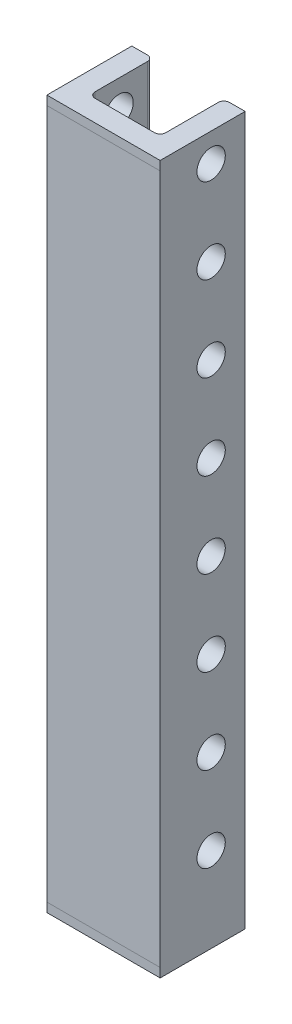
from build123d import *

# Parameters (mm, degrees)
BOSS_EXTRUDE1_DEPTH = 317.5
SKETCH2_R           = 6.35
CUT_EXTRUDE1_DEPTH  = 304.8
FILLET1_R           = 2.54


with BuildPart() as part:
    # Sketch1 → Boss-Extrude1 (new body)
    with BuildSketch(Plane(origin=(0, 0, 0), x_dir=(1, 0, 0), z_dir=(0, 1, 0))):
        Polygon((0, 0), (50.8, 0), (50.8, 38.1), (41.275, 38.1), (41.275, 9.525), (9.525, 9.525), (9.525, 38.1), (0, 38.1), align=None)
    extrude(amount=BOSS_EXTRUDE1_DEPTH)

    # Sketch2 → Cut-Extrude1 (cut)
    with BuildSketch(Plane(origin=(50.8, 0, 0), x_dir=(0, 0, -1), z_dir=(1, 0, 0))):
        with Locations((22.86, 304.8)):
            Circle(SKETCH2_R)
        with Locations((22.86, 190.5)):
            Circle(SKETCH2_R)
        with Locations((22.86, 228.6)):
            Circle(SKETCH2_R)
        with Locations((22.86, 266.7)):
            Circle(SKETCH2_R)
        with Locations((22.86, 76.2)):
            Circle(SKETCH2_R)
        with Locations((22.86, 38.1)):
            Circle(SKETCH2_R)
        with Locations((22.86, 152.4)):
            Circle(SKETCH2_R)
        with Locations((22.86, 114.3)):
            Circle(SKETCH2_R)
    extrude(amount=-CUT_EXTRUDE1_DEPTH, mode=Mode.SUBTRACT)

    # Fillet1
    fillet1_edges = [part.edges().sort_by_distance(p)[0] for p in [
        (41.275, 158.75, -38.1),
        (9.525, 158.75, -38.1),
        (9.525, 158.75, -9.525),
        (41.275, 158.75, -9.525),
    ]]
    fillet(fillet1_edges, radius=FILLET1_R)


solid = part.part
